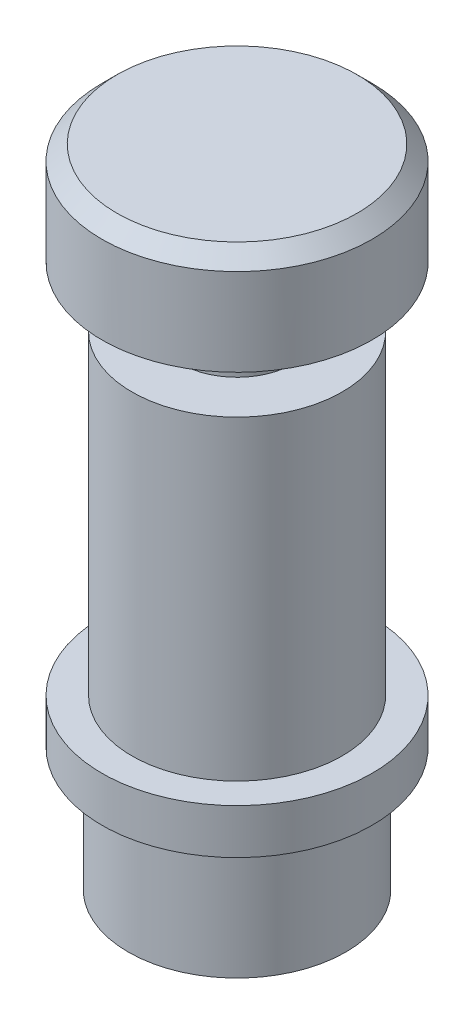
from build123d import *

# Parameters (mm, degrees)
CHAMFER1_SIZE = 1


with BuildPart() as part:
    # Sketch2 → Revolve5 (revolve)
    with BuildSketch(Plane.XY, mode=Mode.PRIVATE) as revolve5_sk:
        Polygon((0, 0), (7.25, 0), (7.25, 8.188595098), (9, 8.188595098), (9, 11.188595098), (7, 11.188595098), (7, 32.188595098), (3.75, 32.188595098), (3.75, 36.188595098), (9, 36.188595098), (9, 43), (0, 43), align=None)
    revolve(revolve5_sk.sketch.rotate(Axis((0, 0, 0), (0, 1, 0)), 90), axis=Axis((0, 0, 0), (0, 1, 0)))

    # Chamfer1
    chamfer1_edges = [part.edges().sort_by_distance(p)[0] for p in [
        (0, 43, 9),
    ]]
    chamfer(chamfer1_edges, length=CHAMFER1_SIZE)


solid = part.part
